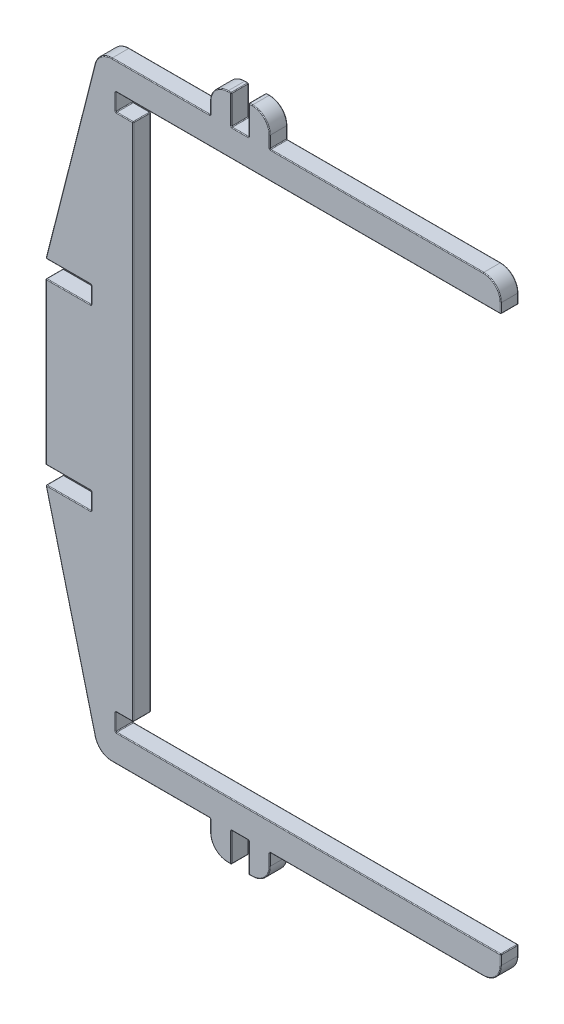
from build123d import *

# Parameters (mm, degrees)
ESBO_O1_W                = 2.5
ESBO_O1_H                = 74.2
RESSALTO_EXTRUS_O1_DEPTH = 2.5
FILETE1_R                = 0.1


with BuildPart() as part:
    # Esboço1 → Ressalto-extrusão1 (new body)
    with BuildSketch(Plane.XY):
        with BuildLine():
            ThreePointArc((136.685562008, 158.637062875), (136.394362431, 158.184981222), (136.206578181, 157.681084317))
            Line((136.206578181, 157.681084317), (129.185562008, 130.065087369))
            Line((129.185562008, 130.065087369), (135.685562008, 130.065087369))
            Line((135.685562008, 130.065087369), (135.685562008, 127.565087369))
            Line((135.685562008, 127.565087369), (129.185562008, 127.565087369))
            Line((129.185562008, 127.565087369), (129.185562008, 104.565087369))
            Line((129.185562008, 104.565087369), (135.685562008, 104.565087369))
            Line((135.685562008, 104.565087369), (135.685562008, 102.065087369))
            Line((135.685562008, 102.065087369), (129.185562008, 102.065087369))
            Line((129.185562008, 102.065087369), (136.206578181, 74.449090421))
            ThreePointArc((136.206578181, 74.449090421), (136.394362431, 73.945193516), (136.685562008, 73.493111863))
            Line((136.685562008, 73.493111863), (136.685562008, 158.637062875))
        make_face()
        with BuildLine():
            ThreePointArc((138.629499509, 159.565087369), (137.552452334, 159.321183418), (136.685562008, 158.637062875))
            Line((136.685562008, 158.637062875), (136.685562008, 73.493111863))
            ThreePointArc((136.685562008, 73.493111863), (137.552452334, 72.80899132), (138.629499509, 72.565087369))
            Line((138.629499509, 72.565087369), (152.685562008, 72.565087369))
            Line((152.685562008, 72.565087369), (155.685562008, 72.565087369))
            Line((155.685562008, 72.565087369), (158.185562008, 72.565087369))
            Line((158.185562008, 72.565087369), (161.185562008, 72.565087369))
            Line((161.185562008, 72.565087369), (191.685562008, 72.565087369))
            ThreePointArc((191.685562008, 72.565087369), (193.453328961, 73.297320416), (194.185562008, 75.065087369))
            Line((194.185562008, 75.065087369), (194.185562008, 76.465087369))
            Line((194.185562008, 76.465087369), (139.185562008, 76.465087369))
            Line((139.185562008, 76.465087369), (139.185562008, 78.965087369))
            Line((139.185562008, 78.965087369), (139.185562008, 153.165087369))
            Line((139.185562008, 153.165087369), (139.185562008, 155.665087369))
            Line((139.185562008, 155.665087369), (194.185562008, 155.665087369))
            Line((194.185562008, 155.665087369), (194.185562008, 157.065087369))
            ThreePointArc((194.185562008, 157.065087369), (193.453328961, 158.832854322), (191.685562008, 159.565087369))
            Line((191.685562008, 159.565087369), (161.185562008, 159.565087369))
            Line((161.185562008, 159.565087369), (158.185562008, 159.565087369))
            Line((158.185562008, 159.565087369), (155.685562008, 159.565087369))
            Line((155.685562008, 159.565087369), (152.685562008, 159.565087369))
            Line((152.685562008, 159.565087369), (138.629499509, 159.565087369))
        make_face()
        with Locations((140.435562008, 116.065087369)):
            Rectangle(ESBO_O1_W, ESBO_O1_H)
        with BuildLine():
            Line((158.185562008, 163.785974052), (158.185562008, 159.565087369))
            Line((158.185562008, 159.565087369), (161.185562008, 159.565087369))
            Line((161.185562008, 159.565087369), (161.185562008, 161.285974052))
            ThreePointArc((161.185562008, 161.285974052), (160.453328961, 163.053741005), (158.685562008, 163.785974052))
            Line((158.685562008, 163.785974052), (158.185562008, 163.785974052))
        make_face()
        with BuildLine():
            Line((152.685562008, 161.285974052), (152.685562008, 159.565087369))
            Line((152.685562008, 159.565087369), (155.685562008, 159.565087369))
            Line((155.685562008, 159.565087369), (155.685562008, 163.785974052))
            Line((155.685562008, 163.785974052), (155.185562008, 163.785974052))
            ThreePointArc((155.185562008, 163.785974052), (153.417795055, 163.053741005), (152.685562008, 161.285974052))
        make_face()
        with BuildLine():
            Line((161.185562008, 72.565087369), (158.185562008, 72.565087369))
            Line((158.185562008, 72.565087369), (158.185562008, 68.344200686))
            Line((158.185562008, 68.344200686), (158.685562008, 68.344200686))
            ThreePointArc((158.685562008, 68.344200686), (160.453328961, 69.076433733), (161.185562008, 70.844200686))
            Line((161.185562008, 70.844200686), (161.185562008, 72.565087369))
        make_face()
        with BuildLine():
            Line((155.685562008, 72.565087369), (152.685562008, 72.565087369))
            Line((152.685562008, 72.565087369), (152.685562008, 70.844200686))
            ThreePointArc((152.685562008, 70.844200686), (153.417795055, 69.076433733), (155.185562008, 68.344200686))
            Line((155.185562008, 68.344200686), (155.685562008, 68.344200686))
            Line((155.685562008, 68.344200686), (155.685562008, 72.565087369))
        make_face()
    extrude(amount=RESSALTO_EXTRUS_O1_DEPTH)

    # Filete1
    filete1_edges = [part.edges().sort_by_distance(p)[0] for p in [
        (176.435562008, 159.565087369, 2.5),
        (161.185562008, 160.42553071, 2.5),
        (160.453328961, 163.053741005, 2.5),
        (158.435562008, 163.785974052, 2.5),
        (158.185562008, 161.67553071, 2.5),
        (156.935562008, 159.565087369, 2.5),
        (155.685562008, 161.67553071, 2.5),
        (155.435562008, 163.785974052, 2.5),
        (153.417795055, 163.053741005, 2.5),
        (152.685562008, 160.42553071, 2.5),
        (145.657530759, 159.565087369, 2.5),
        (137.094897341, 159.038661838, 2.5),
        (152.685562008, 71.704644028, 2.5),
        (132.696070095, 143.873085843, 2.5),
        (132.435562008, 130.065087369, 2.5),
        (135.685562008, 128.815087369, 2.5),
        (132.435562008, 127.565087369, 2.5),
        (129.185562008, 116.065087369, 2.5),
        (132.435562008, 104.565087369, 2.5),
        (135.685562008, 103.315087369, 2.5),
        (132.435562008, 102.065087369, 2.5),
        (132.696070095, 88.257088895, 2.5),
        (153.417795055, 69.076433733, 2.5),
        (155.435562008, 68.344200686, 2.5),
        (155.685562008, 70.454644028, 2.5),
        (156.935562008, 72.565087369, 2.5),
        (158.185562008, 70.454644028, 2.5),
        (137.094897341, 73.0915129, 2.5),
        (158.435562008, 68.344200686, 2.5),
        (132.696070095, 88.257088895, 0),
        (132.435562008, 102.065087369, 0),
        (135.685562008, 103.315087369, 0),
        (132.435562008, 104.565087369, 0),
        (160.453328961, 69.076433733, 2.5),
        (129.185562008, 116.065087369, 0),
        (132.435562008, 127.565087369, 0),
        (135.685562008, 128.815087369, 0),
        (132.435562008, 130.065087369, 0),
        (132.696070095, 143.873085843, 0),
        (137.094897341, 159.038661838, 0),
        (145.657530759, 159.565087369, 0),
        (152.685562008, 160.42553071, 0),
        (161.185562008, 71.704644028, 2.5),
        (153.417795055, 163.053741005, 0),
        (155.435562008, 163.785974052, 0),
        (155.685562008, 161.67553071, 0),
        (156.935562008, 159.565087369, 0),
        (158.185562008, 161.67553071, 0),
        (158.435562008, 163.785974052, 0),
        (160.453328961, 163.053741005, 0),
        (176.435562008, 72.565087369, 2.5),
        (161.185562008, 160.42553071, 0),
        (176.435562008, 159.565087369, 0),
        (193.453328961, 158.832854322, 0),
        (194.185562008, 156.365087369, 0),
        (166.685562008, 155.665087369, 0),
        (139.185562008, 154.415087369, 0),
        (140.435562008, 153.165087369, 0),
        (141.685562008, 116.065087369, 0),
        (140.435562008, 78.965087369, 0),
        (139.185562008, 77.715087369, 0),
        (193.453328961, 73.297320416, 2.5),
        (166.685562008, 76.465087369, 0),
        (194.185562008, 75.765087369, 0),
        (193.453328961, 73.297320416, 0),
        (176.435562008, 72.565087369, 0),
        (161.185562008, 71.704644028, 0),
        (160.453328961, 69.076433733, 0),
        (158.435562008, 68.344200686, 0),
        (194.185562008, 75.765087369, 2.5),
        (158.185562008, 70.454644028, 0),
        (156.935562008, 72.565087369, 0),
        (155.685562008, 70.454644028, 0),
        (155.435562008, 68.344200686, 0),
        (153.417795055, 69.076433733, 0),
        (152.685562008, 71.704644028, 0),
        (145.657530759, 72.565087369, 0),
        (166.685562008, 76.465087369, 2.5),
        (137.094897341, 73.0915129, 0),
        (139.185562008, 77.715087369, 2.5),
        (140.435562008, 78.965087369, 2.5),
        (141.685562008, 116.065087369, 2.5),
        (129.185562008, 102.065087369, 1.25),
        (135.685562008, 102.065087369, 1.25),
        (135.685562008, 104.565087369, 1.25),
        (129.185562008, 104.565087369, 1.25),
        (129.185562008, 127.565087369, 1.25),
        (135.685562008, 127.565087369, 1.25),
        (135.685562008, 130.065087369, 1.25),
        (129.185562008, 130.065087369, 1.25),
        (152.685562008, 159.565087369, 1.25),
        (155.685562008, 163.785974052, 1.25),
        (155.685562008, 159.565087369, 1.25),
        (158.185562008, 159.565087369, 1.25),
        (158.185562008, 163.785974052, 1.25),
        (161.185562008, 159.565087369, 1.25),
        (194.185562008, 155.665087369, 1.25),
        (139.185562008, 155.665087369, 1.25),
        (139.185562008, 153.165087369, 1.25),
        (141.685562008, 153.165087369, 1.25),
        (141.685562008, 78.965087369, 1.25),
        (139.185562008, 78.965087369, 1.25),
        (139.185562008, 76.465087369, 1.25),
        (194.185562008, 76.465087369, 1.25),
        (161.185562008, 72.565087369, 1.25),
        (140.435562008, 153.165087369, 2.5),
        (158.185562008, 68.344200686, 1.25),
        (158.185562008, 72.565087369, 1.25),
        (155.685562008, 72.565087369, 1.25),
        (155.685562008, 68.344200686, 1.25),
        (152.685562008, 72.565087369, 1.25),
        (139.185562008, 154.415087369, 2.5),
        (145.657530759, 72.565087369, 2.5),
        (166.685562008, 155.665087369, 2.5),
        (194.185562008, 156.365087369, 2.5),
        (193.453328961, 158.832854322, 2.5),
    ]]
    fillet(filete1_edges, radius=FILETE1_R)


solid = part.part
